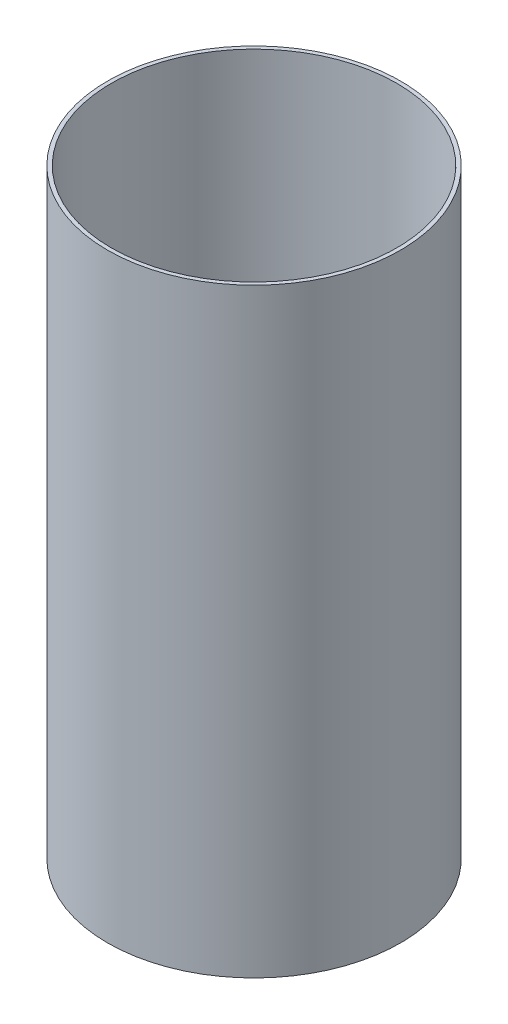
from build123d import *

# Parameters (mm, degrees)
SKETCH1_R           = 76.2
SKETCH1_R_2         = 74.2
BOSS_EXTRUDE1_DEPTH = 312


with BuildPart() as part:
    # Sketch1 → Boss-Extrude1 (new body)
    with BuildSketch(Plane(origin=(0, 0, 0), x_dir=(1, 0, 0), z_dir=(0, 1, 0))):
        with Locations(Location((0, 0, 0), (0, 0, 270))):
            Circle(SKETCH1_R)
        with Locations(Location((0, 0, 0), (0, 0, 270))):
            Circle(SKETCH1_R_2, mode=Mode.SUBTRACT)
    extrude(amount=BOSS_EXTRUDE1_DEPTH)


solid = part.part
